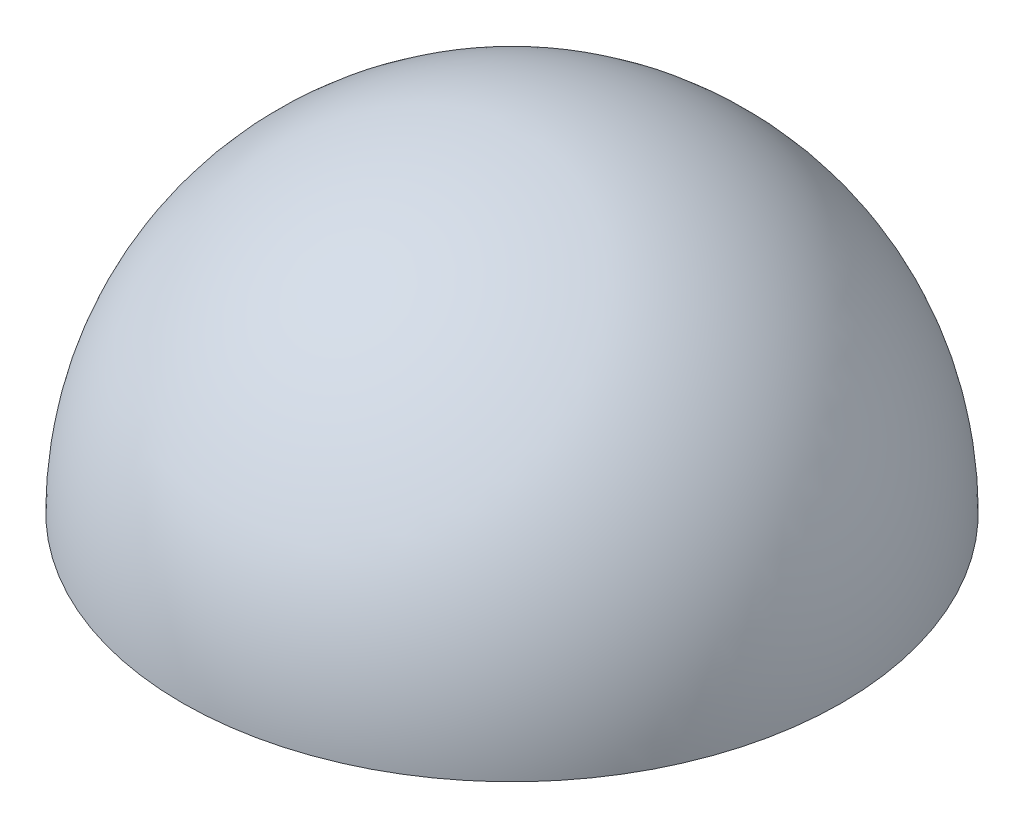
from build123d import *

# Parameters (mm, degrees)
CUT_EXTRUDE1_DEPTH = 5


with BuildPart() as part:
    # Sketch1 → Revolve1 (revolve)
    with BuildSketch(Plane.XY):
        with BuildLine():
            Line((12.5, 0), (0, 0))
            Line((0, 0), (0, 12.5))
            ThreePointArc((0, 12.5), (8.838834765, 8.838834765), (12.5, 0))
        make_face()
    revolve(axis=Axis((0, 0, 0), (0, 1, 0)))

    # Sketch2 → Cut-Extrude1 (cut)
    with BuildSketch(Plane(origin=(0, 0, 0), x_dir=(1, 0, 0), z_dir=(0, 1, 0))):
        Polygon((0, 9), (2.556172718, 3.518269915), (8.559508647, 2.781152949), (4.13597434, -1.343859526), (5.290067271, -7.281152949), (0, -4.348820778), (-5.290067271, -7.281152949), (-4.13597434, -1.343859526), (-8.559508647, 2.781152949), (-2.556172718, 3.518269915), align=None)
    extrude(amount=CUT_EXTRUDE1_DEPTH, mode=Mode.SUBTRACT)


solid = part.part
